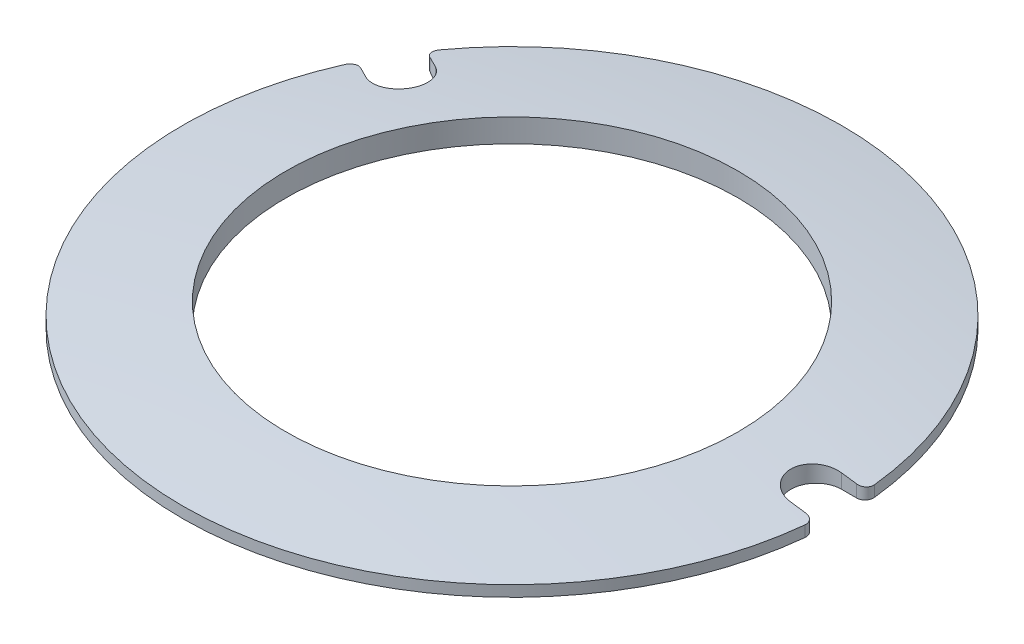
from build123d import *

# Parameters (mm, degrees)
CUT_EXTRUDE2_DEPTH = 283.892205619
FILLET1_R          = 1


with BuildPart() as part:
    # Sketch1 → Revolve1 (revolve)
    with BuildSketch(Plane.XY, mode=Mode.PRIVATE) as revolve1_sk:
        with BuildLine():
            Line((39, 274.708265275), (26.75, 274.708265275))
            Line((26.75, 274.708265275), (26.75, 277.463511115))
            ThreePointArc((26.75, 277.463511115), (32.883051259, 276.803662259), (39, 276.008265275))
            Line((39, 276.008265275), (39, 274.708265275))
        make_face()
    revolve(revolve1_sk.sketch.rotate(Axis((0, 0, 0), (0, 1, 0)), 90), axis=Axis((0, 0, 0), (0, 1, 0)))

    # Sketch2 → Cut-Extrude2 (cut, through all)
    with BuildSketch(Plane(origin=(0, 0, 0), x_dir=(1, 0, 0), z_dir=(0, 1, 0))):
        with BuildLine():
            Line((36, 3), (46, 3))
            ThreePointArc((46, 3), (49, 0), (46, -3))
            Line((46, -3), (36, -3))
            ThreePointArc((36, -3), (33, 0), (36, 3))
        make_face()
        with BuildLine():
            Line((-32.676914536, 15.401923789), (-41.337168574, 20.401923789))
            ThreePointArc((-41.337168574, 20.401923789), (-42.435244785, 24.5), (-38.337168574, 25.598076211))
            Line((-38.337168574, 25.598076211), (-29.676914536, 20.598076211))
            ThreePointArc((-29.676914536, 20.598076211), (-28.578838325, 16.5), (-32.676914536, 15.401923789))
        make_face()
    extrude(amount=CUT_EXTRUDE2_DEPTH, mode=Mode.SUBTRACT)

    # Fillet1
    fillet1_edges = [part.edges().sort_by_distance(p)[0] for p in [
        (38.88444419, 275.358265275, 3),
        (38.88444419, 275.358265275, -3),
        (-32.174916481, 275.358265275, -22.040298307),
        (-35.174916481, 275.358265275, -16.844145884),
    ]]
    fillet(fillet1_edges, radius=FILLET1_R)


solid = part.part
